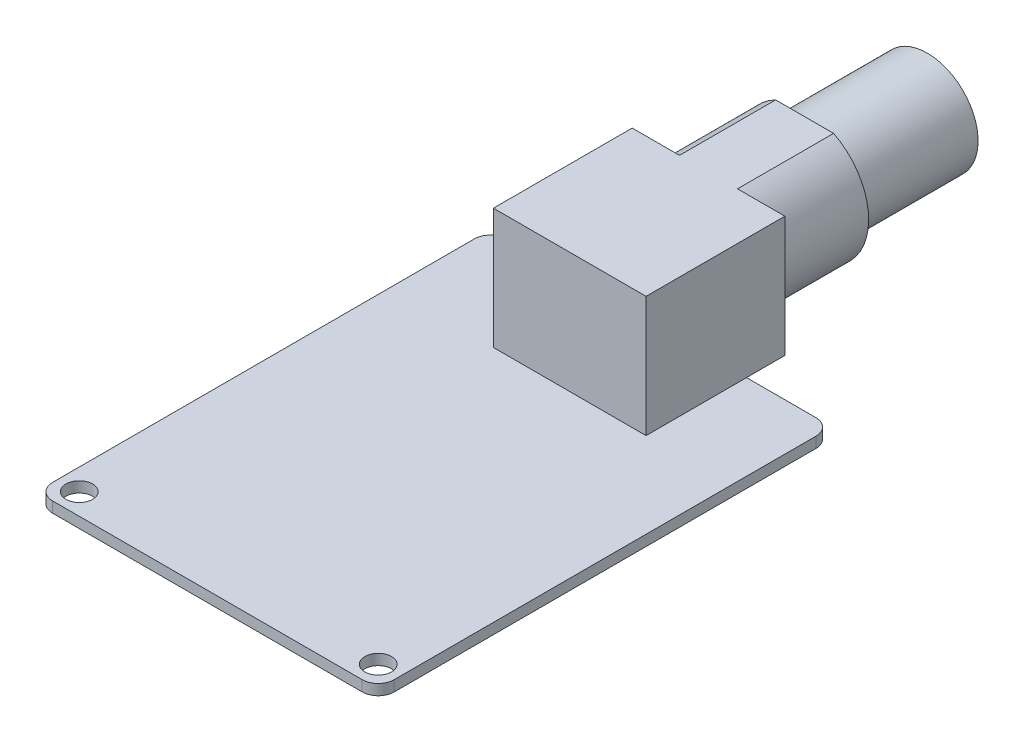
from build123d import *

# Parameters (mm, degrees)
EXTRUDE_1_DEPTH      = 3.5
EXTRUDE_1_DEPTH_BACK = 5.5
SKETCH_1_R           = 6
SKETCH_2_W           = 14.3
SKETCH_2_H           = 11.3
EXTRUDE_2_DEPTH      = 13
SKETCH_3_R           = 1.25
EXTRUDE_3_DEPTH      = 1
SKETCH_4_R           = 4.75
EXTRUDE_4_DEPTH      = 11.5
SKETCH_5_R           = 4.25
CUT_EXTRUDE_1_DEPTH  = 11.5
CUT_EXTRUDE_2_REACH  = 102.61


with BuildPart() as part:
    # 草圖1 → 填料-伸長1 (new, two sides: drawn at the far end of the back side and taken through both)
    with BuildSketch(Plane.XY.offset(-EXTRUDE_1_DEPTH_BACK)):
        with Locations((-64.340909091, 31.5)):
            Circle(SKETCH_1_R)
    extrude(amount=EXTRUDE_1_DEPTH + EXTRUDE_1_DEPTH_BACK)

    # 草圖2 → 填料-伸長2 (add)
    with BuildSketch(Plane.XY.offset(3.5)):
        with Locations((-64.340909091, 31.2)):
            Rectangle(SKETCH_2_W, SKETCH_2_H)
    extrude(amount=EXTRUDE_2_DEPTH)

    # 草圖3 → 填料-伸長3 (add)
    with BuildSketch(Plane.XZ.offset(-25.55)):
        with BuildLine():
            Line((-50.690909091, 7.087920564), (-79.690909091, 7.087920564))
            ThreePointArc((-79.690909091, 7.087920564), (-80.751569263, 7.527260393), (-81.190909091, 8.587920564))
            Line((-81.190909091, 8.587920564), (-81.190909091, 48.087920564))
            ThreePointArc((-81.190909091, 48.087920564), (-80.751569263, 49.148580736), (-79.690909091, 49.587920564))
            Line((-79.690909091, 49.587920564), (-50.690909091, 49.587920564))
            ThreePointArc((-50.690909091, 49.587920564), (-49.630248919, 49.148580736), (-49.190909091, 48.087920564))
            Line((-49.190909091, 48.087920564), (-49.190909091, 8.587920564))
            ThreePointArc((-49.190909091, 8.587920564), (-49.630248919, 7.527260393), (-50.690909091, 7.087920564))
        make_face()
        with Locations(Location((-51.190909091, 47.587920564, 0), (0, 0, 270))):
            Circle(SKETCH_3_R, mode=Mode.SUBTRACT)
        with Locations(Location((-79.190909091, 47.587920564, 0), (0, 0, 270))):
            Circle(SKETCH_3_R, mode=Mode.SUBTRACT)
    extrude(amount=EXTRUDE_3_DEPTH)

    # 草圖4 → 填料-伸長4 (add)
    with BuildSketch(Plane(origin=(0, 0, -5.5), x_dir=(-1, 0, 0), z_dir=(0, 0, -1))):
        with Locations((64.340909091, 31.5)):
            Circle(SKETCH_4_R)
    extrude(amount=EXTRUDE_4_DEPTH)

    # 草圖5 → 除料-伸長1 (cut)
    with BuildSketch(Plane(origin=(0, 0, -17), x_dir=(-1, 0, 0), z_dir=(0, 0, -1))):
        with Locations((64.340909091, 31.5)):
            Circle(SKETCH_5_R)
    extrude(amount=-CUT_EXTRUDE_1_DEPTH, mode=Mode.SUBTRACT)

    # 草圖6 → 除料-伸長2 (cut, up to next)
    with BuildSketch(Plane.XY.offset(3.5), mode=Mode.PRIVATE) as cut_extrude_2_sk1:
        with BuildLine():
            Line((-67.057064462, 36.85), (-61.62475372, 36.85))
            ThreePointArc((-61.62475372, 36.85), (-64.340909091, 37.5), (-67.057064462, 36.85))
        make_face()
    cut_extrude_2_tool1 = extrude(cut_extrude_2_sk1.sketch, amount=-CUT_EXTRUDE_2_REACH, mode=Mode.PRIVATE) & part.part
    add(cut_extrude_2_tool1.solids().sort_by_distance((-64.340909, 37.111246, 3.5))[0], mode=Mode.SUBTRACT)


solid = part.part
